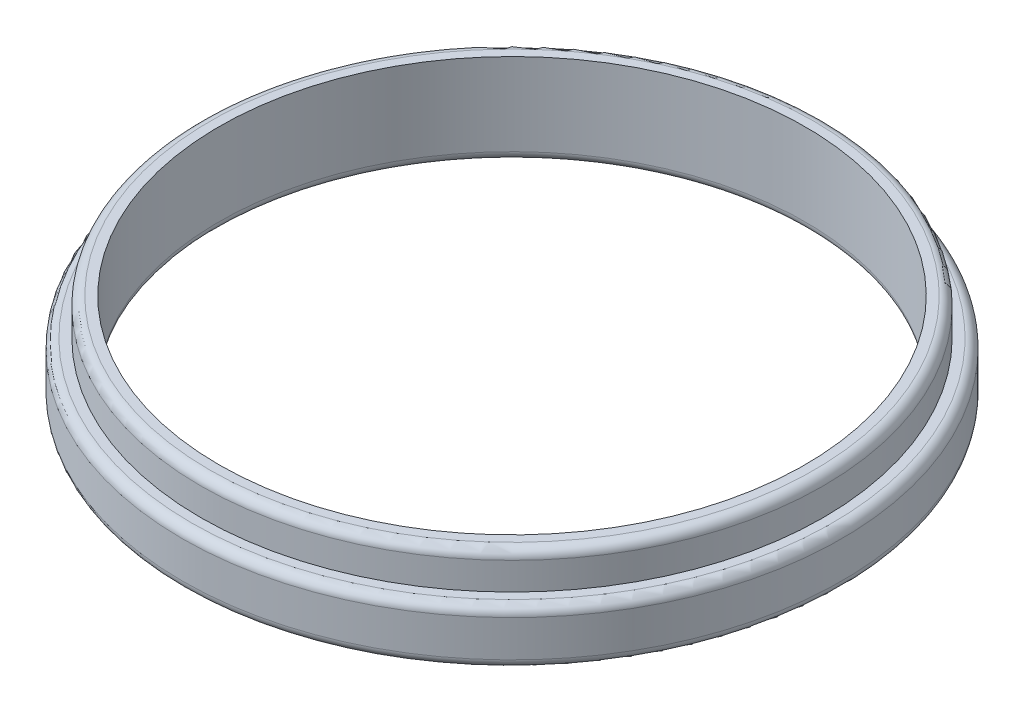
from build123d import *

# Parameters (mm, degrees)
CROQUIS1_R              = 9
SALIENTE_EXTRUIR1_DEPTH = 1.5
CROQUIS2_R              = 8.5
SALIENTE_EXTRUIR2_DEPTH = 1
VACIADO1_T              = -1
CROQUIS3_R              = 8
CORTAR_EXTRUIR1_DEPTH   = 13.971121771
REDONDEO1_R             = 0.25
REDONDEO3_R             = 0.25
REDONDEO4_R             = 0.25
REDONDEO5_R             = 0.25


with BuildPart() as part:
    # Croquis1 → Saliente-Extruir1 (new body)
    with BuildSketch(Plane(origin=(0, 0, 0), x_dir=(1, 0, 0), z_dir=(0, 1, 0))):
        with Locations(Location((0, 0, 0), (0, 0, 270))):
            Circle(CROQUIS1_R)
    extrude(amount=SALIENTE_EXTRUIR1_DEPTH)

    # Croquis2 → Saliente-Extruir2 (add)
    with BuildSketch(Plane(origin=(0, 1.5, 0), x_dir=(1, 0, 0), z_dir=(0, 1, 0))):
        with Locations(Location((0, 0, 0), (0, 0, 270))):
            Circle(CROQUIS2_R)
    extrude(amount=SALIENTE_EXTRUIR2_DEPTH)

    # Vaciado1
    vaciado1_openings = [part.faces().sort_by_distance(p)[0] for p in [
        (0, 0, 0),
    ]]
    offset(amount=VACIADO1_T, openings=vaciado1_openings, kind=Kind.INTERSECTION)

    # Croquis3 → Cortar-Extruir1 (cut, through all)
    with BuildSketch(Plane(origin=(0, 2.5, 0), x_dir=(1, 0, 0), z_dir=(0, 1, 0))):
        with Locations(Location((0, 0, 0), (0, 0, 270))):
            Circle(CROQUIS3_R)
    extrude(amount=-CORTAR_EXTRUIR1_DEPTH, mode=Mode.SUBTRACT)

    # Redondeo1
    redondeo1_edges = [part.edges().sort_by_distance(p)[0] for p in [
        (0, 1.5, -9),
    ]]
    fillet(redondeo1_edges, radius=REDONDEO1_R)

    # Redondeo3
    redondeo3_edges = [part.edges().sort_by_distance(p)[0] for p in [
        (0, 2.5, -8.5),
    ]]
    fillet(redondeo3_edges, radius=REDONDEO3_R)

    # Redondeo4
    redondeo4_edges = [part.edges().sort_by_distance(p)[0] for p in [
        (0, 0, -9),
    ]]
    fillet(redondeo4_edges, radius=REDONDEO4_R)

    # Redondeo5
    redondeo5_edges = [part.edges().sort_by_distance(p)[0] for p in [
        (0, 0, -8),
    ]]
    fillet(redondeo5_edges, radius=REDONDEO5_R)


solid = part.part
